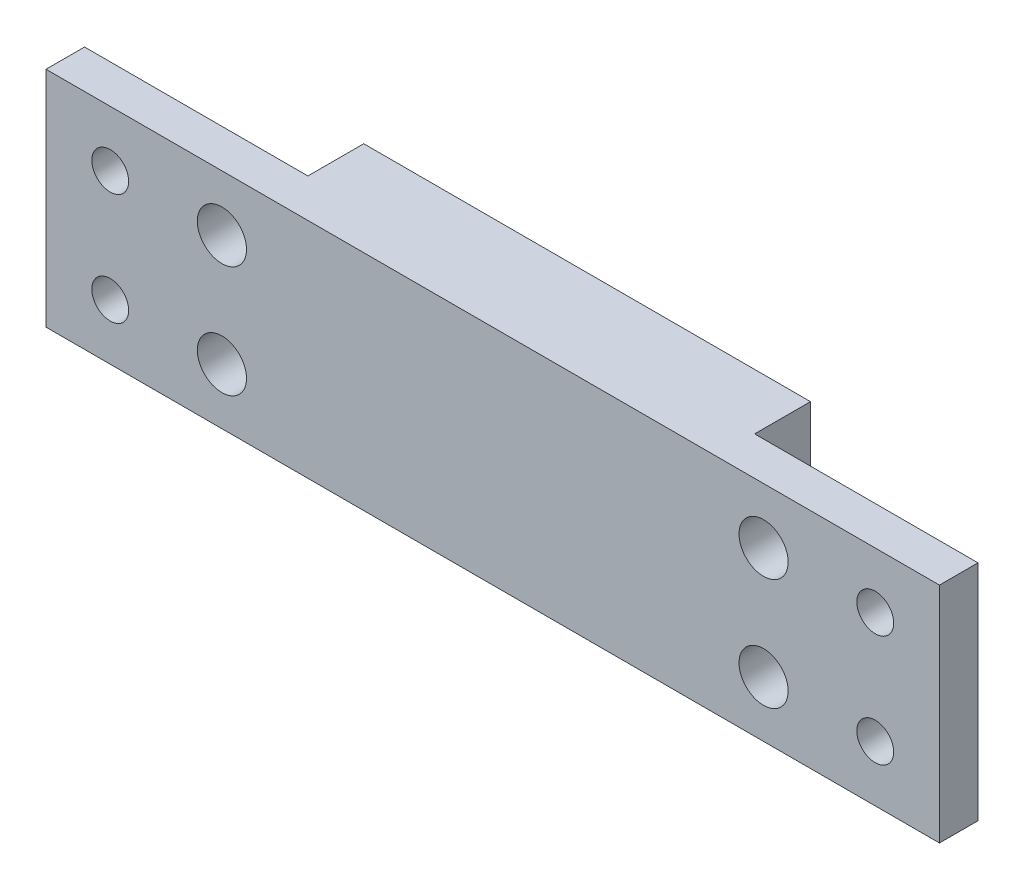
from build123d import *

# Parameters (mm, degrees)
SKETCH_1_W          = 60
SKETCH_1_H          = 20
EXTRUDE_1_DEPTH     = 3.45
SKETCH_2_W          = 40
SKETCH_2_H          = 20
EXTRUDE_2_DEPTH     = 5
SKETCH_4_W          = 80
SKETCH_4_H          = 20
EXTRUDE_3_DEPTH     = 3.45
SKETCH_7_R          = 2.2
SKETCH_7_R_2        = 1.65
CUT_EXTRUDE_1_DEPTH = 3.45


with BuildPart() as part:
    # 草图1 → 凸台-拉伸1 (new body)
    with BuildSketch(Plane.XY):
        with Locations((30, 10)):
            Rectangle(SKETCH_1_W, SKETCH_1_H)
    extrude(amount=EXTRUDE_1_DEPTH)

    # 草图2 → 凸台-拉伸2 (add)
    with BuildSketch(Plane(origin=(0, 0, 0), x_dir=(-1, 0, 0), z_dir=(0, 0, -1))):
        with Locations((-30, 10)):
            Rectangle(SKETCH_2_W, SKETCH_2_H)
    extrude(amount=EXTRUDE_2_DEPTH)

    # 草图4 → 凸台-拉伸3 (add)
    with BuildSketch(Plane(origin=(0, 0, 0), x_dir=(-1, 0, 0), z_dir=(0, 0, -1))):
        with Locations((-30, 10)):
            Rectangle(SKETCH_4_W, SKETCH_4_H)
    extrude(amount=-EXTRUDE_3_DEPTH)

    # 草图7 → 切除-拉伸1 (cut)
    with BuildSketch(Plane.XY.offset(3.45)):
        with Locations((5.75, 15.001516812)):
            Circle(SKETCH_7_R)
        with Locations((54.25, 15)):
            Circle(SKETCH_7_R)
        with Locations((54.25, 5)):
            Circle(SKETCH_7_R)
        with Locations((5.75, 5)):
            Circle(SKETCH_7_R)
        with Locations((-4.249999943, 15.000444876)):
            Circle(SKETCH_7_R_2)
        with Locations((-4.249999943, 5)):
            Circle(SKETCH_7_R_2)
        with Locations((64.25, 5)):
            Circle(SKETCH_7_R_2)
        with Locations((64.25, 15)):
            Circle(SKETCH_7_R_2)
    extrude(amount=-CUT_EXTRUDE_1_DEPTH, mode=Mode.SUBTRACT)


solid = part.part
